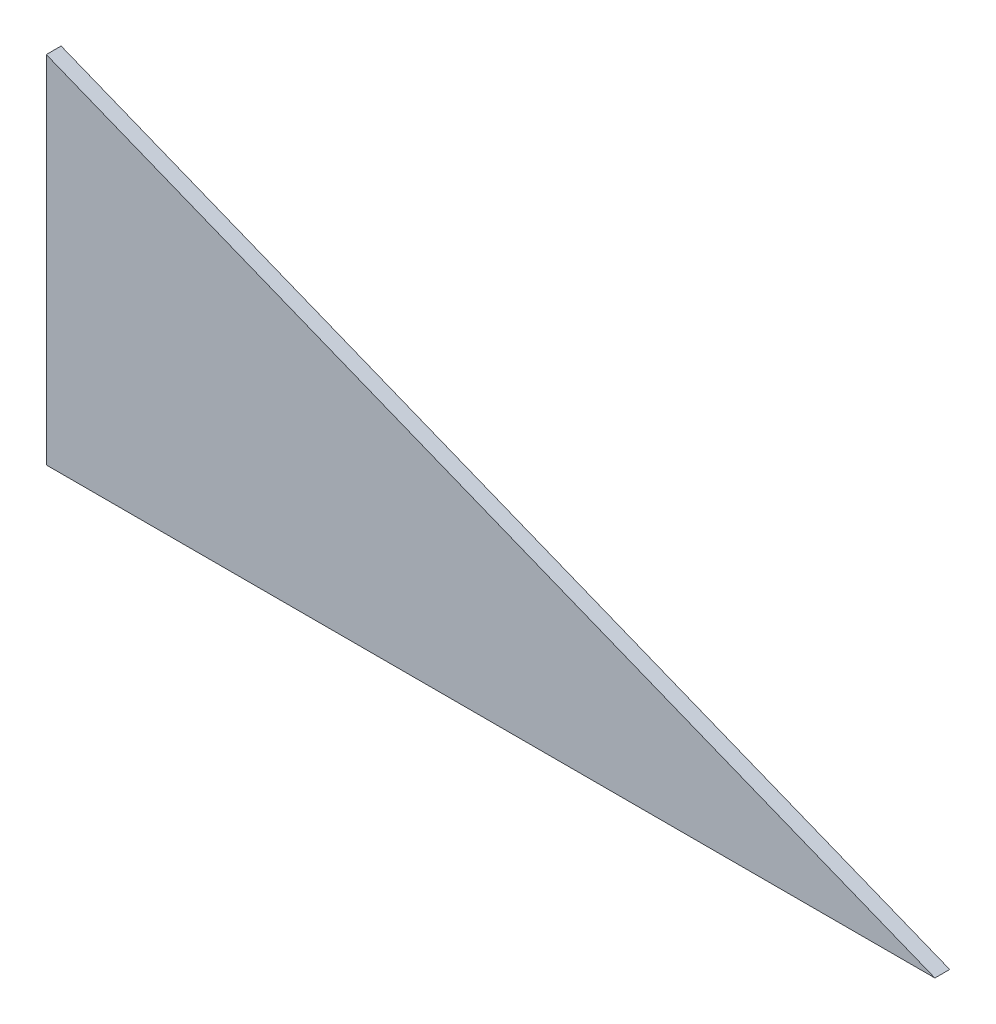
from build123d import *

# Parameters (mm, degrees)
BOSS_EXTRUDE1_DEPTH = 3.175


with BuildPart() as part:
    # Sketch1 → Boss-Extrude1 (new body)
    with BuildSketch(Plane.XY):
        Polygon((0, 76.2), (0, 0), (190.5, 0), align=None)
    extrude(amount=BOSS_EXTRUDE1_DEPTH)


solid = part.part
